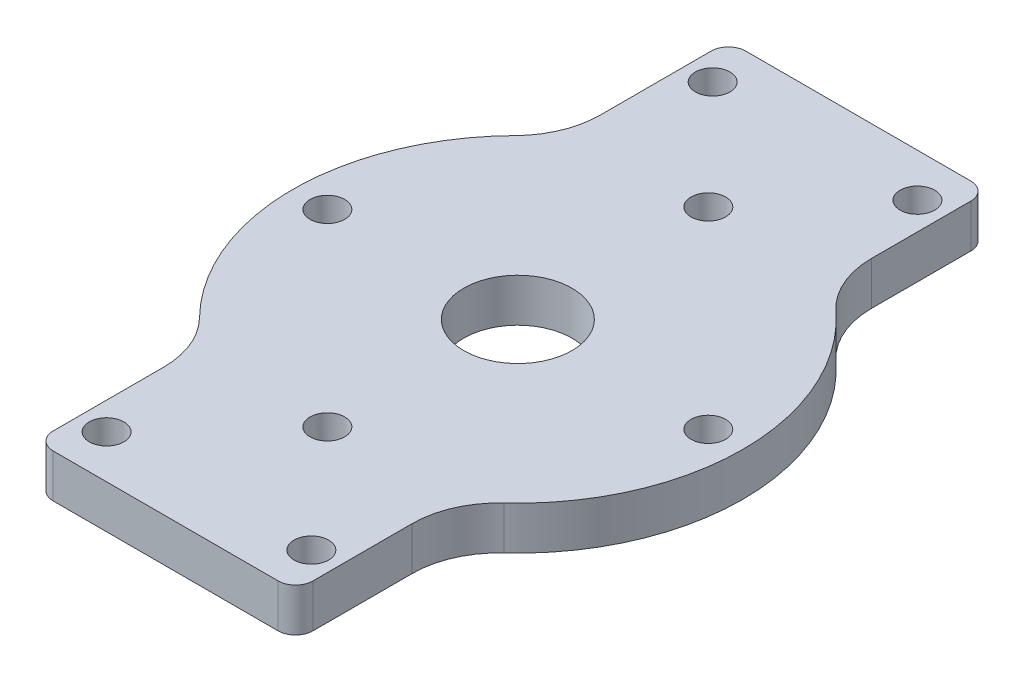
from build123d import *

# Parameters (mm, degrees)
Y_KSEKLIK_EKSTR_ZYON1_DEPTH = 2.5
IZIM2_R                     = 2
KES_EKSTR_ZYON1_DEPTH       = 27
DAIRESEL_KAPLAMA1_COUNT     = 2
DAIRESEL_KAPLAMA1_ANGLE     = 90
IZIM3_R                     = 6.25
KES_EKSTR_ZYON2_DEPTH       = 27
IZIM4_R                     = 2
KES_EKSTR_ZYON3_DEPTH       = 27
RADYUS1_R                   = 2


with BuildPart() as part:
    # Çizim1 → Yükseklik-Ekstrüzyon1 (new, symmetric)
    with BuildSketch(Plane(origin=(0, 0, 0), x_dir=(1, 0, 0), z_dir=(0, 1, 0))):
        with BuildLine():
            Line((-15.675675676, 40), (-15.675675676, 25.234097539))
            ThreePointArc((-15.675675676, 25.234097539), (-16.420371215, 21.447365526), (-18.543543544, 18.224626))
            ThreePointArc((-18.543543544, 18.224626), (-26, 0), (-18.543543544, -18.224626))
            ThreePointArc((-18.543543544, -18.224626), (-16.420371215, -21.447365526), (-15.675675676, -25.234097539))
            Line((-15.675675676, -25.234097539), (-15.675675676, -40))
            Line((-15.675675676, -40), (14.324324324, -40))
            Line((14.324324324, -40), (14.324324324, -26.539164383))
            ThreePointArc((14.324324324, -26.539164383), (15.170976096, -22.512228052), (17.567567568, -19.167174277))
            ThreePointArc((17.567567568, -19.167174277), (26, 0), (17.567567568, 19.167174277))
            ThreePointArc((17.567567568, 19.167174277), (15.170976096, 22.512228052), (14.324324324, 26.539164383))
            Line((14.324324324, 26.539164383), (14.324324324, 40))
            Line((14.324324324, 40), (-15.675675676, 40))
        make_face()
    extrude(amount=Y_KSEKLIK_EKSTR_ZYON1_DEPTH, both=True)

    # Çizim2 → Kes-Ekstrüzyon1 (cut)
    with BuildSketch(Plane(origin=(0, 2.5, 0), x_dir=(1, 0, 0), z_dir=(0, 1, 0))):
        with Locations(Location((-22, 0, 0), (0, 0, 270))):
            Circle(IZIM2_R)
        with Locations(Location((22, 0, 0), (0, 0, 270))):
            Circle(IZIM2_R)
    kes_ekstr_zyon1 = extrude(amount=-KES_EKSTR_ZYON1_DEPTH, mode=Mode.SUBTRACT)

    # Dairesel Kaplama1: Kes-Ekstrüzyon1 ×2 about axis
    dairesel_kaplama1_axis = Axis((-0.246697988, 0, 0), (0, 1, 0))
    for i in range(1, DAIRESEL_KAPLAMA1_COUNT):
        add(kes_ekstr_zyon1.rotate(dairesel_kaplama1_axis, i * DAIRESEL_KAPLAMA1_ANGLE / (DAIRESEL_KAPLAMA1_COUNT - 1)), mode=Mode.SUBTRACT)

    # Çizim3 → Kes-Ekstrüzyon2 (cut)
    with BuildSketch(Plane(origin=(0, 2.5, 0), x_dir=(1, 0, 0), z_dir=(0, 1, 0))):
        with Locations(Location((0, 0, 0), (0, 0, 270))):
            Circle(IZIM3_R)
    extrude(amount=-KES_EKSTR_ZYON2_DEPTH, mode=Mode.SUBTRACT)

    # Çizim4 → Kes-Ekstrüzyon3 (cut)
    with BuildSketch(Plane(origin=(0, 2.5, 0), x_dir=(1, 0, 0), z_dir=(0, 1, 0))):
        with Locations(Location((-12.5, 35, 0), (0, 0, 270))):
            Circle(IZIM4_R)
        with Locations(Location((11.148648649, 35, 0), (0, 0, 270))):
            Circle(IZIM4_R)
    kes_ekstr_zyon3 = extrude(amount=-KES_EKSTR_ZYON3_DEPTH, mode=Mode.SUBTRACT)

    # Aynalama1: Kes-Ekstrüzyon3 across plane
    add(kes_ekstr_zyon3.mirror(Plane.XY), mode=Mode.SUBTRACT)

    # Radyus1
    radyus1_edges = [part.edges().sort_by_distance(p)[0] for p in [
        (-15.675675676, 0, -40),
        (14.324324324, 0, -40),
        (14.324324324, 0, 40),
        (-15.675675676, 0, 40),
    ]]
    fillet(radyus1_edges, radius=RADYUS1_R)


solid = part.part
